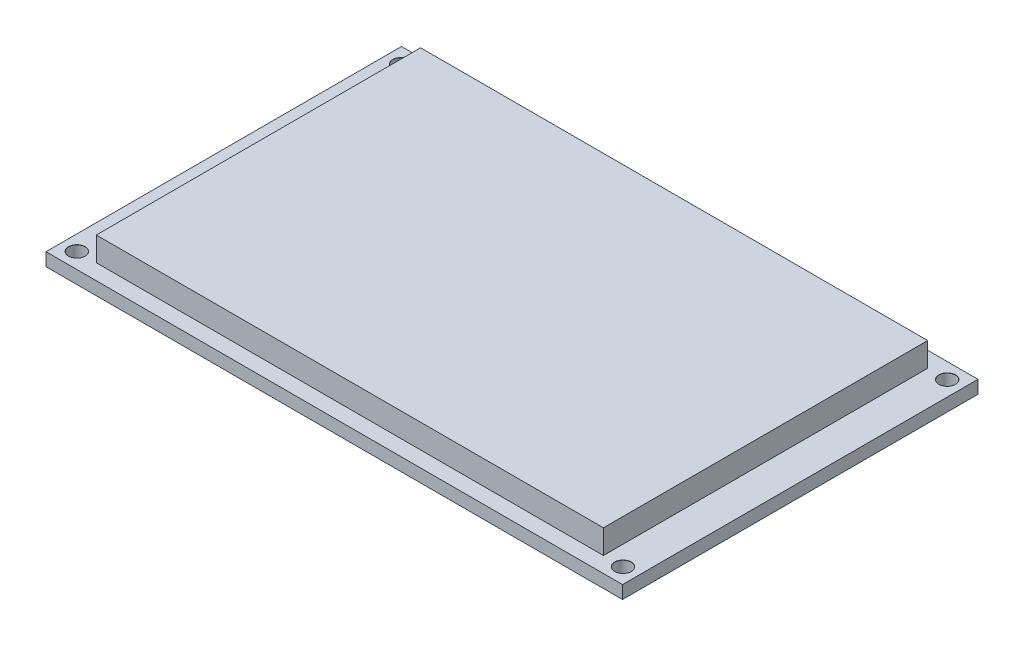
from build123d import *

# Parameters (mm, degrees)
SKETCH1_W                      = 120
SKETCH1_H                      = 74
BOSS_EXTRUDE1_DEPTH            = 2.7
SKETCH2_W                      = 105.56
SKETCH2_H                      = 67.5
BOSS_EXTRUDE2_DEPTH            = 5
M3_CLEARANCE_HOLE1_D           = 3.4
M3_CLEARANCE_HOLE1_CSINK_D     = 3.45
M3_CLEARANCE_HOLE1_CSINK_ANGLE = 90


with BuildPart() as part:
    # Sketch1 → Boss-Extrude1 (new body)
    with BuildSketch(Plane(origin=(0, 0, 0), x_dir=(1, 0, 0), z_dir=(0, 1, 0))):
        Rectangle(SKETCH1_W, SKETCH1_H)
    extrude(amount=BOSS_EXTRUDE1_DEPTH)

    # Sketch2 → Boss-Extrude2 (add)
    with BuildSketch(Plane(origin=(0, 2.7, 0), x_dir=(1, 0, 0), z_dir=(0, 1, 0))):
        Rectangle(SKETCH2_W, SKETCH2_H)
    extrude(amount=BOSS_EXTRUDE2_DEPTH)

    # M3 Clearance Hole1 (through all)
    with Locations(Plane(origin=(0, 2.7, 0), x_dir=(1, 0, 0), z_dir=(0, 1, 0))):
        with Locations((-56.845, 33.735), (56.845, 33.735), (56.845, -33.735), (-56.845, -33.735)):
            CounterSinkHole(M3_CLEARANCE_HOLE1_D / 2, M3_CLEARANCE_HOLE1_CSINK_D / 2, counter_sink_angle=M3_CLEARANCE_HOLE1_CSINK_ANGLE)


solid = part.part
